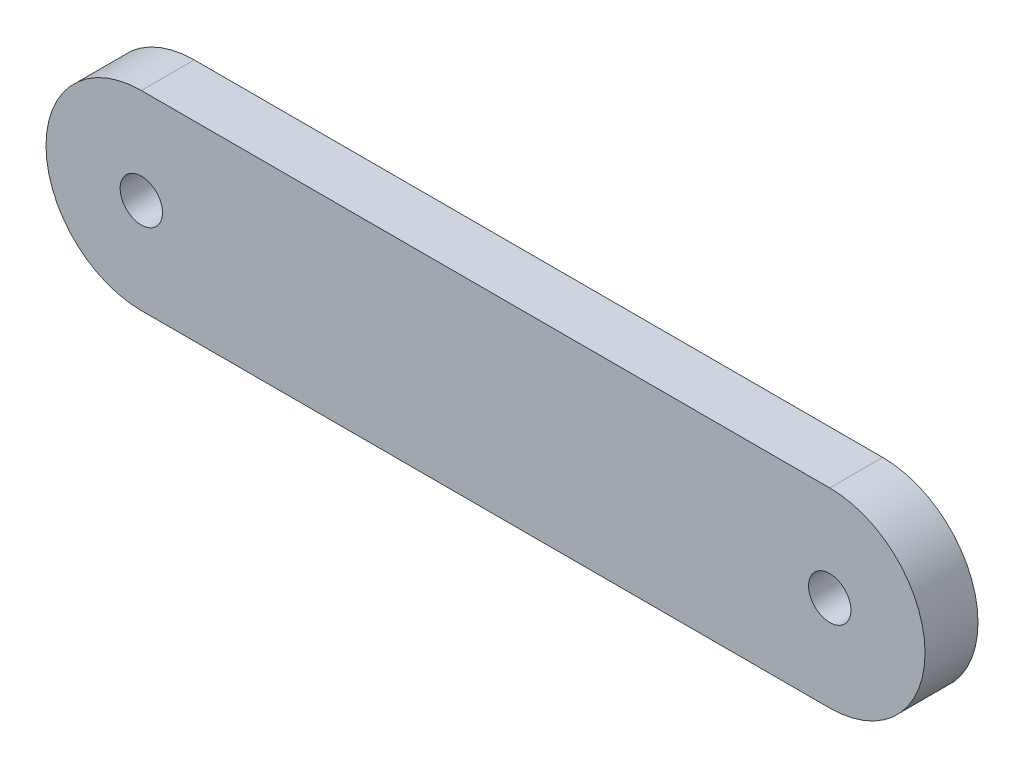
from build123d import *

# Parameters (mm, degrees)
ESQUISSE1_R        = 2
BOSS_EXTRU_1_DEPTH = 5


with BuildPart() as part:
    # Esquisse1 → Boss.-Extru.1 (new body)
    with BuildSketch(Plane.XY):
        with BuildLine():
            Line((0, 9), (65, 9))
            ThreePointArc((65, 9), (74, 0), (65, -9))
            Line((65, -9), (0, -9))
            ThreePointArc((0, -9), (-9, 0), (0, 9))
        make_face()
        Circle(ESQUISSE1_R, mode=Mode.SUBTRACT)
        with Locations((65, 0)):
            Circle(ESQUISSE1_R, mode=Mode.SUBTRACT)
    extrude(amount=BOSS_EXTRU_1_DEPTH)


solid = part.part
